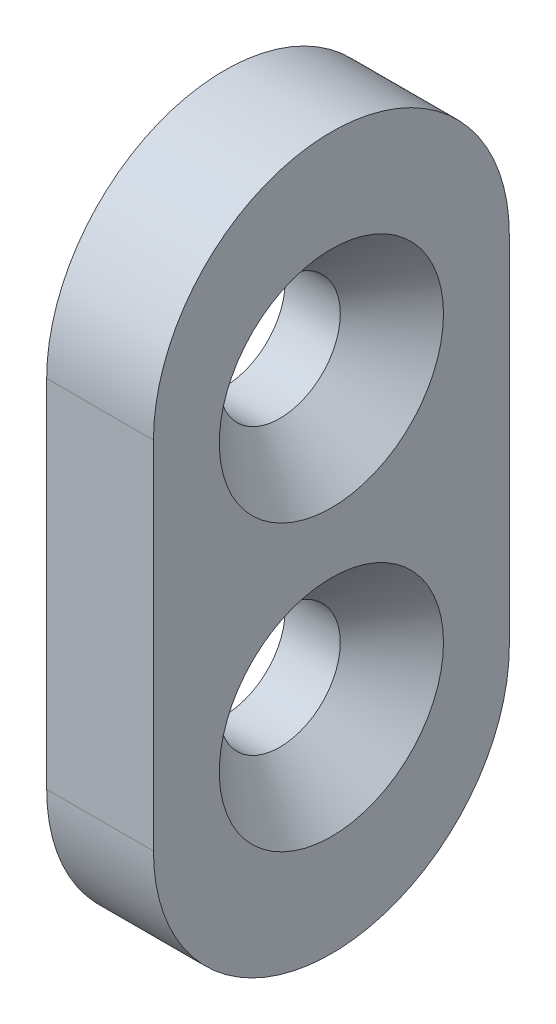
from build123d import *

# Parameters (mm, degrees)
BOSS_EXTRUDE1_DEPTH                          = 1.5
CSK_FOR_M3_COUNTERSUNK_FLAT_HEAD_SCR_2_COUNT = 2
CSK_FOR_M3_COUNTERSUNK_FLAT_HEAD_SCR_2_PITCH = 8


with BuildPart() as part:
    # Sketch1 → Boss-Extrude1 (new, symmetric)
    with BuildSketch(Plane(origin=(0, 0, 0), x_dir=(0, 0, -1), z_dir=(1, 0, 0))):
        with BuildLine():
            Line((5, 5), (5, -5))
            ThreePointArc((5, -5), (0, -10), (-5, -5))
            Line((-5, -5), (-5, 5))
            ThreePointArc((-5, 5), (0, 10), (5, 5))
        make_face()
    extrude(amount=BOSS_EXTRUDE1_DEPTH, both=True)

    # Sketch3 → CSK for M3 Countersunk Flat Head Screw1 (revolve, cut)
    with BuildSketch(Plane(origin=(1.5, 4, 0), x_dir=(0, 0, -1), z_dir=(0, 1, 0))):
        Polygon((0, 0), (0, 3), (1.7, 3), (1.7, 1.45), (3.15, 0), align=None)
    csk_for_m3_countersunk_flat_head_screw1 = revolve(axis=Axis((7.85, 4, 0), (-1, 0, 0)), mode=Mode.SUBTRACT)

    # CSK for M3 Countersunk Flat Head Scr 2: CSK for M3 Countersunk Flat Head Screw1 ×2
    with Locations(*[(0, -i * CSK_FOR_M3_COUNTERSUNK_FLAT_HEAD_SCR_2_PITCH, 0) for i in range(1, CSK_FOR_M3_COUNTERSUNK_FLAT_HEAD_SCR_2_COUNT)]):
        add(csk_for_m3_countersunk_flat_head_screw1, mode=Mode.SUBTRACT)


solid = part.part
